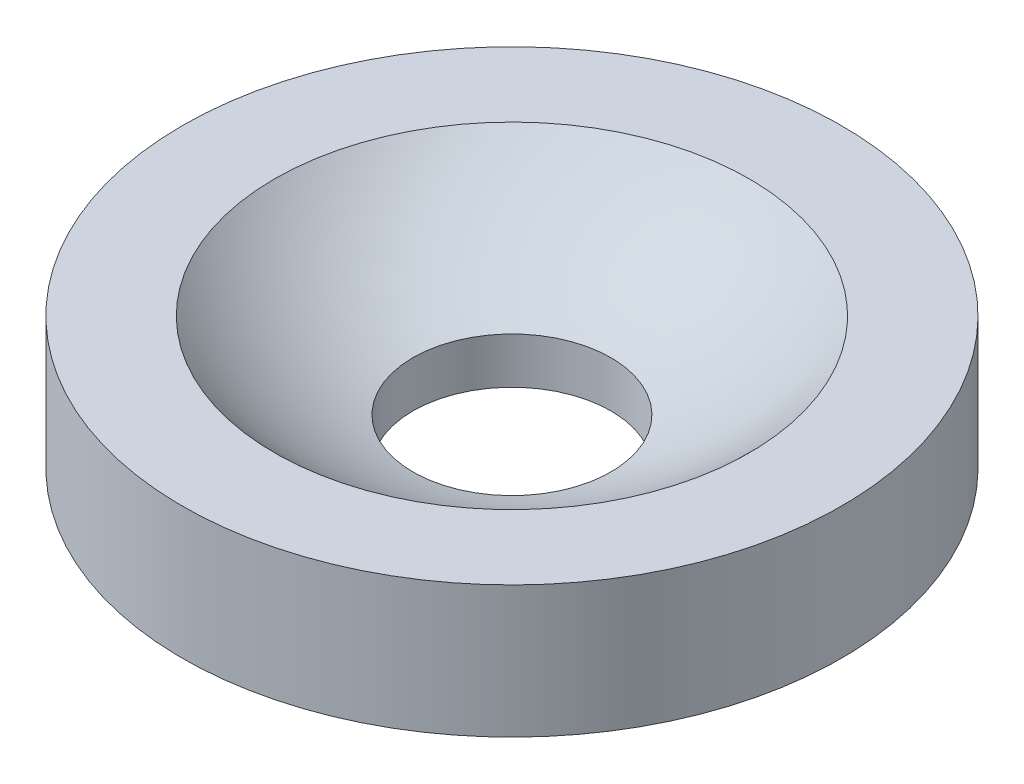
from build123d import *


with BuildPart() as part:
    # 草图1 → 旋转1 (revolve)
    with BuildSketch(Plane.XY, mode=Mode.PRIVATE) as revolve_1_sk:
        Polygon((3.5, 2), (5, 2), (5, 0), (1.502113226, 0), (1.502113226, 0.7), align=None)
    revolve(revolve_1_sk.sketch.rotate(Axis((0, 0, 0), (0, -1, 0)), 180), axis=Axis((0, 0, 0), (0, -1, 0)))

    # 草图2 → 切除-旋转2 (revolve, cut)
    with BuildSketch(Plane.XY):
        with BuildLine():
            Line((0, 0.469030914), (0, 10.469030914))
            ThreePointArc((0, 10.469030914), (5, 5.469030914), (0, 0.469030914))
        make_face()
    revolve(axis=Axis((0, 0, 0), (0, 1, 0)), mode=Mode.SUBTRACT)


solid = part.part
